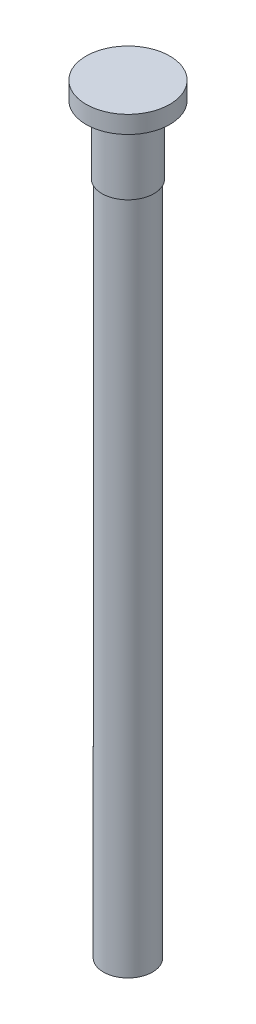
from build123d import *

# Parameters (mm, degrees)
SKETCH1_R           = 2.9464
BOSS_EXTRUDE1_DEPTH = 89.0143
SKETCH2_R           = 5.0165
BOSS_EXTRUDE2_DEPTH = 2.0955
SKETCH3_R           = 3.1115
BOSS_EXTRUDE3_DEPTH = 8.128


with BuildPart() as part:
    # Sketch1 → Boss-Extrude1 (new body)
    with BuildSketch(Plane(origin=(0, 0, 0), x_dir=(1, 0, 0), z_dir=(0, 1, 0))):
        with Locations(Location((0, 0, 0), (0, 0, 270))):
            Circle(SKETCH1_R)
    extrude(amount=-BOSS_EXTRUDE1_DEPTH)

    # Sketch2 → Boss-Extrude2 (add)
    with BuildSketch(Plane(origin=(0, 0, 0), x_dir=(1, 0, 0), z_dir=(0, 1, 0))):
        with Locations(Location((0, 0, 0), (0, 0, 270))):
            Circle(SKETCH2_R)
    extrude(amount=BOSS_EXTRUDE2_DEPTH)

    # Sketch3 → Boss-Extrude3 (add)
    with BuildSketch(Plane.XZ):
        with Locations(Location((0, 0, 0), (0, 0, 90))):
            Circle(SKETCH3_R)
    extrude(amount=BOSS_EXTRUDE3_DEPTH)


solid = part.part
